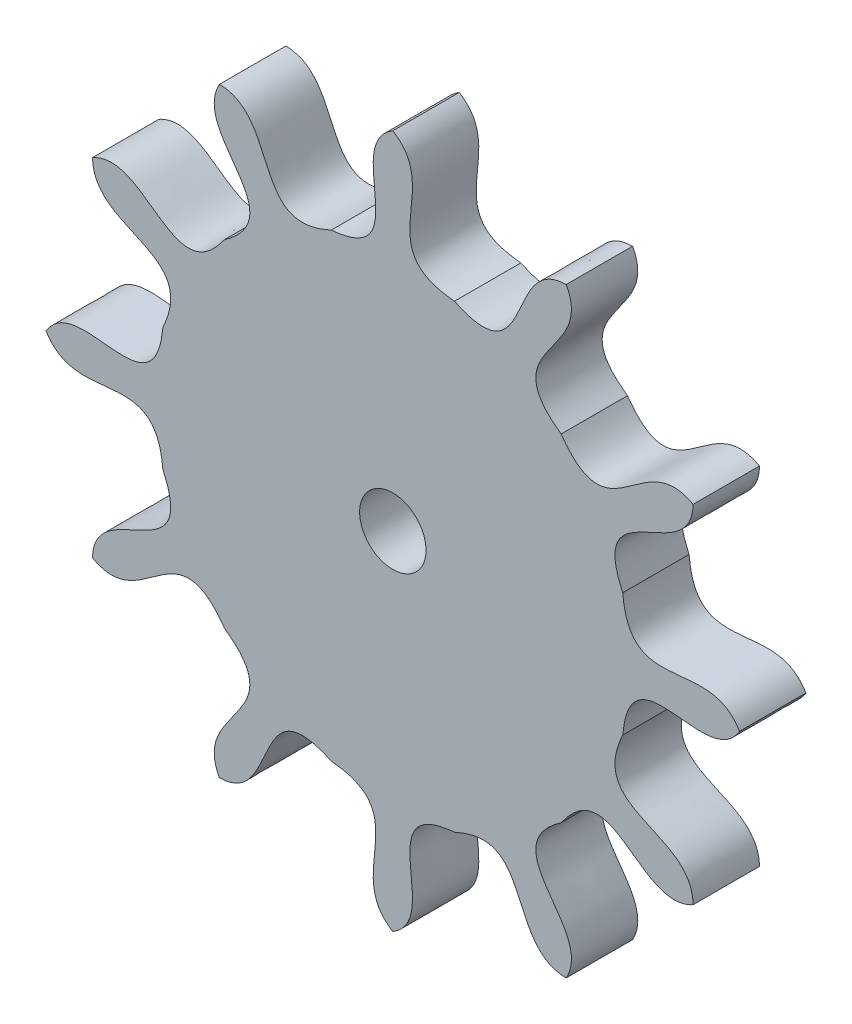
from build123d import *

# Parameters (mm, degrees)
BOSS_EXTRUDE4_DEPTH = 5
SKETCH10_R          = 2.5
CUT_EXTRUDE3_DEPTH  = 5


with BuildPart() as part:
    # Sketch9 → Boss-Extrude4 (new body)
    with BuildSketch(Plane.XY):
        with BuildLine():
            add(Edge.make_bspline(
                [(0, 26.124355653), (3.884864274, 23.788582221), (-1.912523876, 17.903903592), (4.641256317, 17.321404385)],
                knots=[0, 0, 0, 0, 1, 1, 1, 1], degree=3))
            add(Edge.make_bspline(
                [(13.062177826, 22.624355653), (8.529899959, 22.54394866), (10.608246058, 14.5489734), (4.641256317, 17.321404385)],
                knots=[0, 0, 0, 0, 1, 1, 1, 1], degree=3))
            add(Edge.make_bspline(
                [(13.062177826, 22.624355653), (15.258682262, 18.659084387), (7.295657534, 16.461497276), (12.680148068, 12.680148068)],
                knots=[0, 0, 0, 0, 1, 1, 1, 1], degree=3))
            add(Edge.make_bspline(
                [(22.624355653, 13.062177826), (18.659084387, 15.258682262), (16.461497276, 7.295657534), (12.680148068, 12.680148068)],
                knots=[0, 0, 0, 0, 1, 1, 1, 1], degree=3))
            add(Edge.make_bspline(
                [(22.624355653, 13.062177826), (22.54394866, 8.529899959), (14.5489734, 10.608246058), (17.321404385, 4.641256317)],
                knots=[0, 0, 0, 0, 1, 1, 1, 1], degree=3))
            add(Edge.make_bspline(
                [(26.124355653, 0), (23.788582221, 3.884864274), (17.903903592, -1.912523876), (17.321404385, 4.641256317)],
                knots=[0, 0, 0, 0, 1, 1, 1, 1], degree=3))
            add(Edge.make_bspline(
                [(26.124355653, 0), (23.788582221, -3.884864274), (17.903903592, 1.912523876), (17.321404385, -4.641256317)],
                knots=[0, 0, 0, 0, 1, 1, 1, 1], degree=3))
            add(Edge.make_bspline(
                [(22.624355653, -13.062177826), (22.54394866, -8.529899959), (14.5489734, -10.608246058), (17.321404385, -4.641256317)],
                knots=[0, 0, 0, 0, 1, 1, 1, 1], degree=3))
            add(Edge.make_bspline(
                [(22.624355653, -13.062177826), (18.659084387, -15.258682262), (16.461497276, -7.295657534), (12.680148068, -12.680148068)],
                knots=[0, 0, 0, 0, 1, 1, 1, 1], degree=3))
            add(Edge.make_bspline(
                [(13.062177826, -22.624355653), (15.258682262, -18.659084387), (7.295657534, -16.461497276), (12.680148068, -12.680148068)],
                knots=[0, 0, 0, 0, 1, 1, 1, 1], degree=3))
            add(Edge.make_bspline(
                [(13.062177826, -22.624355653), (8.529899959, -22.54394866), (10.608246058, -14.5489734), (4.641256317, -17.321404385)],
                knots=[0, 0, 0, 0, 1, 1, 1, 1], degree=3))
            add(Edge.make_bspline(
                [(0, -26.124355653), (3.884864274, -23.788582221), (-1.912523876, -17.903903592), (4.641256317, -17.321404385)],
                knots=[0, 0, 0, 0, 1, 1, 1, 1], degree=3))
            add(Edge.make_bspline(
                [(0, -26.124355653), (-3.884864274, -23.788582221), (1.912523876, -17.903903592), (-4.641256317, -17.321404385)],
                knots=[0, 0, 0, 0, 1, 1, 1, 1], degree=3))
            add(Edge.make_bspline(
                [(-13.062177826, -22.624355653), (-8.529899959, -22.54394866), (-10.608246058, -14.5489734), (-4.641256317, -17.321404385)],
                knots=[0, 0, 0, 0, 1, 1, 1, 1], degree=3))
            add(Edge.make_bspline(
                [(-13.062177826, -22.624355653), (-15.258682262, -18.659084387), (-7.295657534, -16.461497276), (-12.680148068, -12.680148068)],
                knots=[0, 0, 0, 0, 1, 1, 1, 1], degree=3))
            add(Edge.make_bspline(
                [(-22.624355653, -13.062177826), (-18.659084387, -15.258682262), (-16.461497276, -7.295657534), (-12.680148068, -12.680148068)],
                knots=[0, 0, 0, 0, 1, 1, 1, 1], degree=3))
            add(Edge.make_bspline(
                [(-22.624355653, -13.062177826), (-22.54394866, -8.529899959), (-14.5489734, -10.608246058), (-17.321404385, -4.641256317)],
                knots=[0, 0, 0, 0, 1, 1, 1, 1], degree=3))
            add(Edge.make_bspline(
                [(-26.124355653, 0), (-23.788582221, -3.884864274), (-17.903903592, 1.912523876), (-17.321404385, -4.641256317)],
                knots=[0, 0, 0, 0, 1, 1, 1, 1], degree=3))
            add(Edge.make_bspline(
                [(-26.124355653, 0), (-23.788582221, 3.884864274), (-17.903903592, -1.912523876), (-17.321404385, 4.641256317)],
                knots=[0, 0, 0, 0, 1, 1, 1, 1], degree=3))
            add(Edge.make_bspline(
                [(-22.624355653, 13.062177826), (-22.54394866, 8.529899959), (-14.5489734, 10.608246058), (-17.321404385, 4.641256317)],
                knots=[0, 0, 0, 0, 1, 1, 1, 1], degree=3))
            add(Edge.make_bspline(
                [(-22.624355653, 13.062177826), (-18.659084387, 15.258682262), (-16.461497276, 7.295657534), (-12.680148068, 12.680148068)],
                knots=[0, 0, 0, 0, 1, 1, 1, 1], degree=3))
            add(Edge.make_bspline(
                [(-13.062177826, 22.624355653), (-15.258682262, 18.659084387), (-7.295657534, 16.461497276), (-12.680148068, 12.680148068)],
                knots=[0, 0, 0, 0, 1, 1, 1, 1], degree=3))
            add(Edge.make_bspline(
                [(-13.062177826, 22.624355653), (-8.529899959, 22.54394866), (-10.608246058, 14.5489734), (-4.641256317, 17.321404385)],
                knots=[0, 0, 0, 0, 1, 1, 1, 1], degree=3))
            add(Edge.make_bspline(
                [(0, 26.124355653), (-3.884864274, 23.788582221), (1.912523876, 17.903903592), (-4.641256317, 17.321404385)],
                knots=[0, 0, 0, 0, 1, 1, 1, 1], degree=3))
        make_face()
    extrude(amount=BOSS_EXTRUDE4_DEPTH)

    # Sketch10 → Cut-Extrude3 (cut)
    with BuildSketch(Plane.XY.offset(5)):
        Circle(SKETCH10_R)
    extrude(amount=-CUT_EXTRUDE3_DEPTH, mode=Mode.SUBTRACT)


solid = part.part
